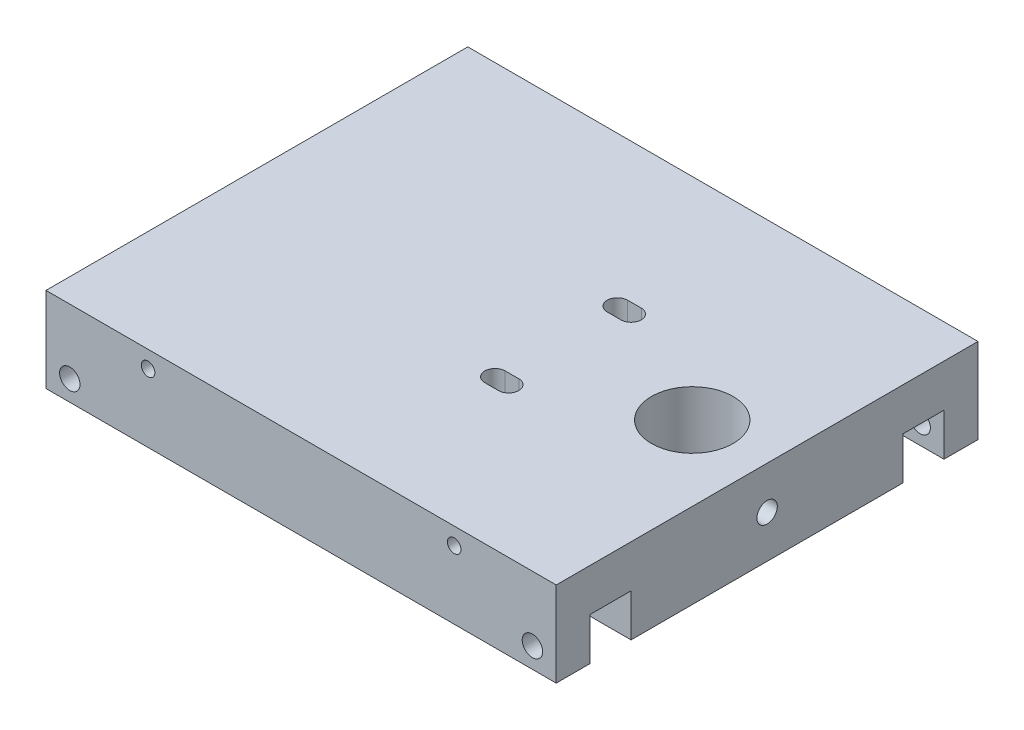
from build123d import *

# Parameters (mm, degrees)
SKETCH1_W             = 150
SKETCH1_H             = 10
BOSS_EXTRUDE1_DEPTH   = 12.5
SKETCH1_H_2           = 80
SKETCH1_R             = 12
BOSS_EXTRUDE1_2_DEPTH = 12.5
BOSS_EXTRUDE1_3_DEPTH = 12.5
BOSS_EXTRUDE2_START   = 12.5
SKETCH1_3_W           = 150
SKETCH1_3_H           = 124
SKETCH1_3_R           = 12
BOSS_EXTRUDE2_DEPTH   = 12.5
SKETCH2_R             = 3
CUT_EXTRUDE1_DEPTH    = 101.468900661
CUT_EXTRUDE2_DEPTH    = 10
SKETCH3_R             = 3
CUT_EXTRUDE3_DEPTH    = 15
SKETCH4_R             = 2
SKETCH4_R_2           = 3
CUT_EXTRUDE4_DEPTH    = 18
CUT_EXTRUDE5_START    = -106
SKETCH4_2_R           = 2
SKETCH4_2_R_2         = 3
CUT_EXTRUDE5_DEPTH    = 18


with BuildPart() as part:
    # Sketch1 → Boss-Extrude1 (new body)
    with BuildSketch(Plane(origin=(0, 0, 0), x_dir=(1, 0, 0), z_dir=(0, 1, 0))):
        with Locations((0, 57)):
            Rectangle(SKETCH1_W, SKETCH1_H)
    extrude(amount=BOSS_EXTRUDE1_DEPTH)



with BuildPart() as body_2:
    # Sketch1 → Boss-Extrude1 2 (new body)
    with BuildSketch(Plane(origin=(0, 0, 0), x_dir=(1, 0, 0), z_dir=(0, 1, 0))):
        Rectangle(SKETCH1_W, SKETCH1_H_2)
        with Locations(Location((53, 0, 0), (0, 0, 270))):
            Circle(SKETCH1_R, mode=Mode.SUBTRACT)
    extrude(amount=BOSS_EXTRUDE1_2_DEPTH)


with BuildPart() as body_3:
    # Sketch1 → Boss-Extrude1 3 (new body)
    with BuildSketch(Plane(origin=(0, 0, 0), x_dir=(1, 0, 0), z_dir=(0, 1, 0))):
        with Locations((0, -57)):
            Rectangle(SKETCH1_W, SKETCH1_H)
    extrude(amount=BOSS_EXTRUDE1_3_DEPTH)


with BuildPart() as part_1:
    add(part.part)

    add(body_2.part)  # Boss-Extrude2 merges body 2

    add(body_3.part)  # Boss-Extrude2 merges body 3
    # Sketch1<3> → Boss-Extrude2 (add)
    with BuildSketch(Plane(origin=(0, 0, 0), x_dir=(1, 0, 0), z_dir=(0, 1, 0)).offset(BOSS_EXTRUDE2_START)):
        Rectangle(SKETCH1_3_W, SKETCH1_3_H)
        with Locations(Location((53, 0, 0), (0, 0, 270))):
            Circle(SKETCH1_3_R, mode=Mode.SUBTRACT)
    extrude(amount=BOSS_EXTRUDE2_DEPTH)

    # Sketch2 → Cut-Extrude1 (cut, through all)
    with BuildSketch(Plane.XZ):
        with Locations((13, -18)):
            Circle(SKETCH2_R)
        with Locations((17, -18)):
            Circle(SKETCH2_R)
        with BuildLine():
            Line((17, -15), (13, -15))
            ThreePointArc((13, -15), (14.070466269, -15.197482923), (15, -15.763932023))
            ThreePointArc((15, -15.763932023), (15.929533731, -15.197482923), (17, -15))
        make_face()
        with BuildLine():
            ThreePointArc((15, -20.236067977), (14.070466269, -20.802517077), (13, -21))
            Line((13, -21), (17, -21))
            ThreePointArc((17, -21), (15.929533731, -20.802517077), (15, -20.236067977))
        make_face()
        with Locations((17, 18)):
            Circle(SKETCH2_R)
        with Locations((13, 18)):
            Circle(SKETCH2_R)
        with BuildLine():
            Line((17, 21), (13, 21))
            ThreePointArc((13, 21), (14.070466269, 20.802517077), (15, 20.236067977))
            ThreePointArc((15, 20.236067977), (15.929533731, 20.802517077), (17, 21))
        make_face()
        with BuildLine():
            ThreePointArc((15, 15.763932023), (14.070466269, 15.197482923), (13, 15))
            Line((13, 15), (17, 15))
            ThreePointArc((17, 15), (15.929533731, 15.197482923), (15, 15.763932023))
        make_face()
    extrude(amount=-CUT_EXTRUDE1_DEPTH, mode=Mode.SUBTRACT)

    # Sketch2<3> → Cut-Extrude2 (cut)
    # profile 1 of 2: a face of its own
    with BuildSketch(Plane.XZ):
        with BuildLine():
            Line((17, 25), (13, 25))
            ThreePointArc((13, 25), (6, 18), (13, 11))
            Line((13, 11), (17, 11))
            ThreePointArc((17, 11), (24, 18), (17, 25))
        make_face()
        with BuildLine():
            ThreePointArc((13, 15), (10, 18), (13, 21))
            Line((13, 21), (17, 21))
            ThreePointArc((17, 21), (19.121320344, 20.121320344), (20, 18))
            ThreePointArc((20, 18), (19.121320344, 15.878679656), (17, 15))
            Line((17, 15), (13, 15))
        make_face(mode=Mode.SUBTRACT)
    # profile 2 of 2: a face of its own
    with BuildSketch(Plane.XZ):
        with BuildLine():
            Line((17, -11), (13, -11))
            ThreePointArc((13, -11), (6, -18), (13, -25))
            Line((13, -25), (17, -25))
            ThreePointArc((17, -25), (24, -18), (17, -11))
        make_face()
        with BuildLine():
            ThreePointArc((13, -21), (10, -18), (13, -15))
            Line((13, -15), (17, -15))
            ThreePointArc((17, -15), (19.121320344, -15.878679656), (20, -18))
            ThreePointArc((20, -18), (19.121320344, -20.121320344), (17, -21))
            Line((17, -21), (13, -21))
        make_face(mode=Mode.SUBTRACT)
    extrude(amount=-CUT_EXTRUDE2_DEPTH, mode=Mode.SUBTRACT)

    # Sketch3 → Cut-Extrude3 (cut)
    with BuildSketch(Plane(origin=(75, 0, 0), x_dir=(0, 0, -1), z_dir=(1, 0, 0))):
        with Locations((0, 12.5)):
            Circle(SKETCH3_R)
    extrude(amount=-CUT_EXTRUDE3_DEPTH, mode=Mode.SUBTRACT)

    # Sketch4 → Cut-Extrude4 (cut)
    with BuildSketch(Plane.XY.offset(62)):
        with Locations((-45, 20)):
            Circle(SKETCH4_R)
        with Locations((45, 20)):
            Circle(SKETCH4_R)
        with Locations((-68, 6)):
            Circle(SKETCH4_R_2)
        with Locations(Location((68, 6, 0), (0, 0, 180))):
            Circle(SKETCH4_R_2)
    extrude(amount=-CUT_EXTRUDE4_DEPTH, mode=Mode.SUBTRACT)

    # Sketch4<2> → Cut-Extrude5 (cut)
    with BuildSketch(Plane.XY.offset(62).offset(CUT_EXTRUDE5_START)):
        with Locations((-45, 20)):
            Circle(SKETCH4_2_R)
        with Locations((45, 20)):
            Circle(SKETCH4_2_R)
        with Locations((-68, 6)):
            Circle(SKETCH4_2_R_2)
        with Locations(Location((68, 6, 0), (0, 0, 180))):
            Circle(SKETCH4_2_R_2)
    extrude(amount=-CUT_EXTRUDE5_DEPTH, mode=Mode.SUBTRACT)


solid = part_1.part
